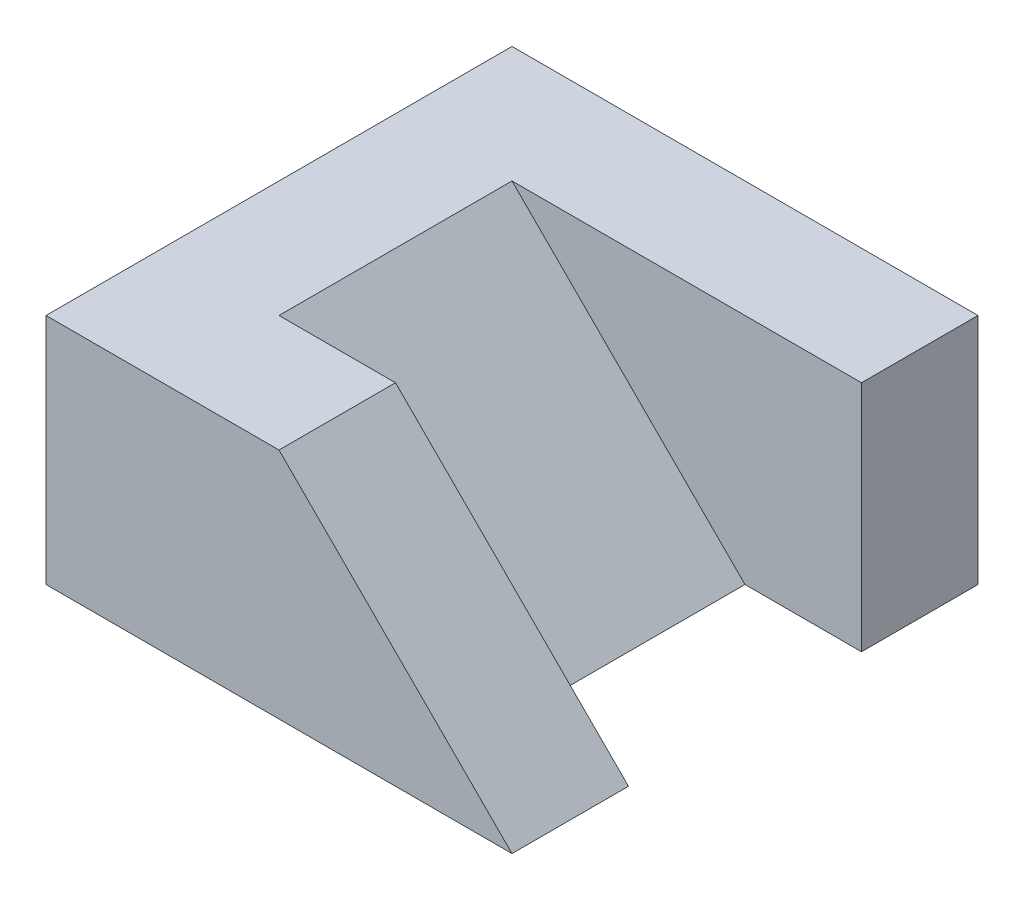
from build123d import *

# Parameters (mm, degrees)
SKETCH_1_W      = 20
SKETCH_1_H      = 10
EXTRUDE_1_DEPTH = 5
SKETCH_2_W      = 5
SKETCH_2_H      = 10
EXTRUDE_2_DEPTH = 10
EXTRUDE_3_DEPTH = 5
EXTRUDE_4_DEPTH = 5


with BuildPart() as part:
    # 草圖1 → 填料-伸長1 (new body)
    with BuildSketch(Plane.XY):
        with Locations((10, 5)):
            Rectangle(SKETCH_1_W, SKETCH_1_H)
    extrude(amount=EXTRUDE_1_DEPTH)

    # 草圖2 → 填料-伸長2 (add)
    with BuildSketch(Plane.XY.offset(5)):
        with Locations((2.5, 5)):
            Rectangle(SKETCH_2_W, SKETCH_2_H)
    extrude(amount=EXTRUDE_2_DEPTH)

    # 草圖3 → 填料-伸長3 (add)
    with BuildSketch(Plane.XY.offset(15)):
        Polygon((0, 0), (20, 0), (10, 10), (0, 10), align=None)
    extrude(amount=EXTRUDE_3_DEPTH)

    # 草圖4 → 填料-伸長4 (add, symmetric)
    with BuildSketch(Plane.XY.offset(10)):
        Polygon((0, 0), (0, 10), (5, 10), (15, 0), align=None)
    extrude(amount=EXTRUDE_4_DEPTH, both=True)


solid = part.part
